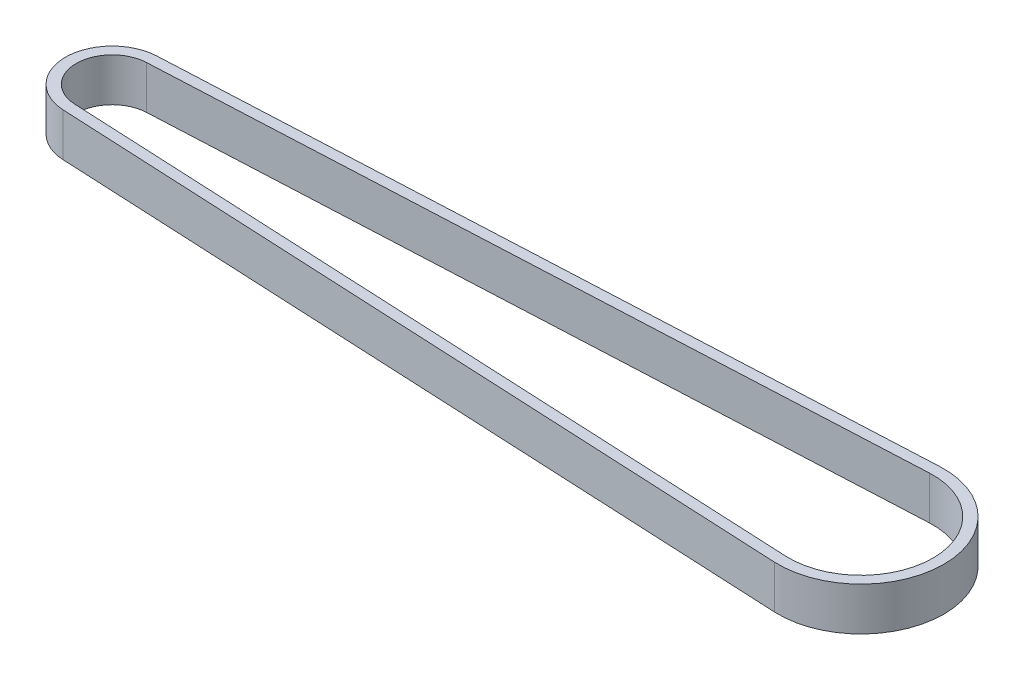
from build123d import *

# Parameters (mm, degrees)
BOSS_EXTRUDE1_DEPTH = 3


with BuildPart() as part:
    # Sketch1 → Boss-Extrude1 (new, symmetric)
    with BuildSketch(Plane(origin=(0, 0, 0), x_dir=(1, 0, 0), z_dir=(0, 1, 0))):
        with BuildLine():
            Line((-0.312560108, 6.492480742), (103.42700904, 11.486696697))
            ThreePointArc((103.42700904, 11.486696697), (115.48, 0), (103.42700904, -11.486696697))
            Line((103.42700904, -11.486696697), (-0.312560108, -6.492480742))
            ThreePointArc((-0.312560108, -6.492480742), (-6.5, 0), (-0.312560108, 6.492480742))
        make_face()
        with BuildLine():
            Line((-0.240430852, 4.994215955), (103.499138296, 9.98843191))
            ThreePointArc((103.499138296, 9.98843191), (113.98, 0), (103.499138296, -9.98843191))
            Line((103.499138296, -9.98843191), (-0.240430852, -4.994215955))
            ThreePointArc((-0.240430852, -4.994215955), (-5, 0), (-0.240430852, 4.994215955))
        make_face(mode=Mode.SUBTRACT)
    extrude(amount=BOSS_EXTRUDE1_DEPTH, both=True)


solid = part.part
